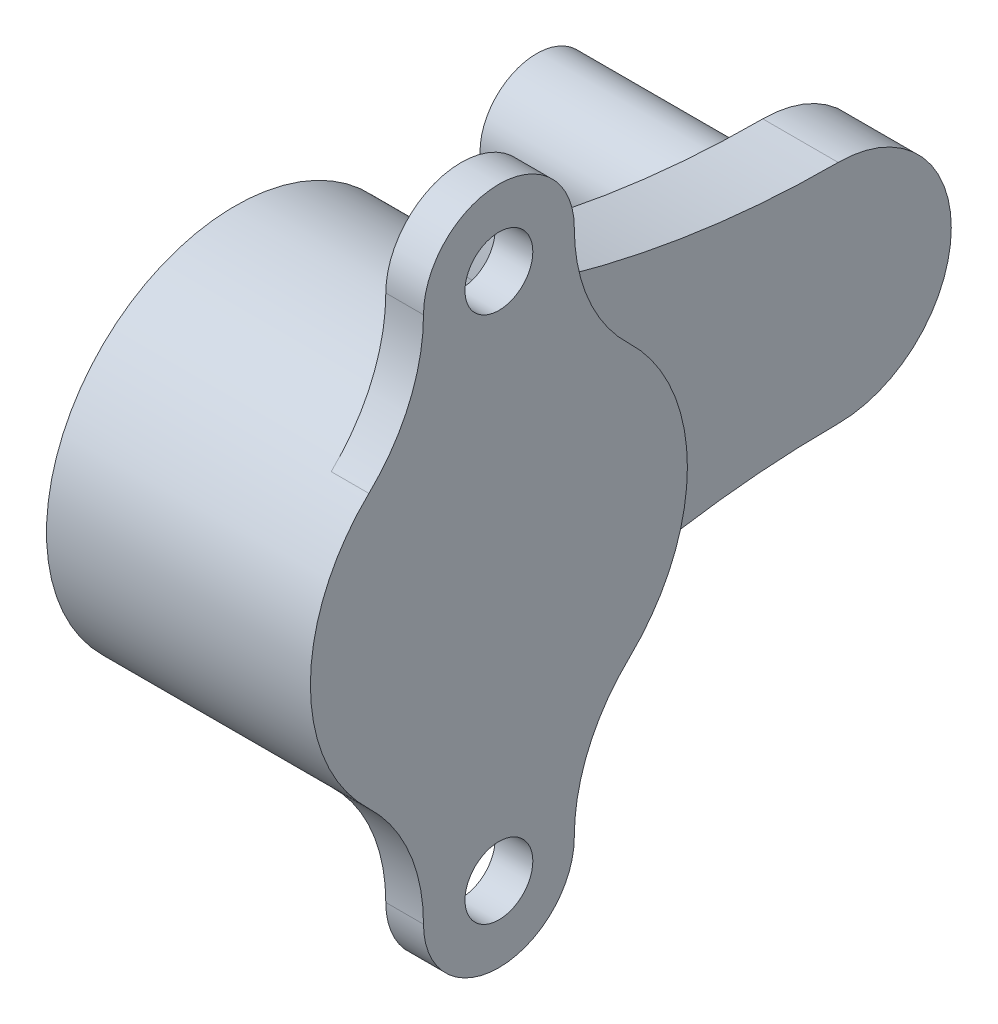
from build123d import *
from build123d.topology import SkipClean

# Parameters (mm, degrees)
FILLET1_R           = 1
SKETCH2_R           = 4.5
BOSS_EXTRUDE2_DEPTH = 5
BOSS_EXTRUDE3_DEPTH = 10
SKETCH4_R           = 7.5
BOSS_EXTRUDE4_DEPTH = 30


with BuildPart() as part:
    # Sketch1 → Revolve1 (revolve)
    with BuildSketch(Plane.XY, mode=Mode.PRIVATE) as revolve1_sk:
        Polygon((15, 25), (-15, 25), (-15, 22.5), (-12.5, 22.5), (-12.5, 7.5), (-15, 7.5), (-15, 5), (15, 5), align=None)
    revolve(revolve1_sk.sketch.rotate(Axis((0, 0, 0), (-1, 0, 0)), 90), axis=Axis((0, 0, 0), (-1, 0, 0)))

    # Fillet1
    fillet1_edges = [part.edges().sort_by_distance(p)[0] for p in [
        (-15, 0, 7.5),
    ]]
    fillet(fillet1_edges, radius=FILLET1_R)

    # Sketch2 → Boss-Extrude2 (add)
    with SkipClean():  # the faces are left unmerged after this step: merging them gives an invalid solid
        with BuildSketch(Plane(origin=(15, 0, 0), x_dir=(0, 0, -1), z_dir=(1, 0, 0))):
            with BuildLine():
                ThreePointArc((10, 35), (0, 45), (-10, 35))
                ThreePointArc((-10, 35), (-11.886615966, 25.8085497), (-17.24137931, 18.103448276))
                ThreePointArc((-17.24137931, 18.103448276), (-25, 0), (-17.24137931, -18.103448276))
                ThreePointArc((-17.24137931, -18.103448276), (-11.886615966, -25.8085497), (-10, -35))
                ThreePointArc((-10, -35), (0, -45), (10, -35))
                ThreePointArc((10, -35), (11.886615966, -25.8085497), (17.24137931, -18.103448276))
                ThreePointArc((17.24137931, -18.103448276), (25, 0), (17.24137931, 18.103448276))
                ThreePointArc((17.24137931, 18.103448276), (11.886615966, 25.8085497), (10, 35))
            make_face()
            with Locations((0, 35)):
                Circle(SKETCH2_R, mode=Mode.SUBTRACT)
            with Locations((0, -35)):
                Circle(SKETCH2_R, mode=Mode.SUBTRACT)
        extrude(amount=BOSS_EXTRUDE2_DEPTH)

    # Sketch3 → Boss-Extrude3 (add)
    with SkipClean():  # the faces are left unmerged after this step: merging them gives an invalid solid
        with BuildSketch(Plane(origin=(0, 0, 0), x_dir=(0, 0, -1), z_dir=(1, 0, 0))):
            with BuildLine():
                Line((8.8, 23.4), (8.8, -23.4))
                ThreePointArc((8.8, -23.4), (31.521286236, -17.117074299), (55, -15))
                ThreePointArc((55, -15), (70, 0), (55, 15))
                ThreePointArc((55, 15), (31.521286236, 17.117074299), (8.8, 23.4))
            make_face()
        extrude(amount=BOSS_EXTRUDE3_DEPTH)

    # Sketch4 → Boss-Extrude4 (add)
    with SkipClean():  # the faces are left unmerged after this step: merging them gives an invalid solid
        with BuildSketch(Plane.ZY):
            with Locations((-55, 0)):
                Circle(SKETCH4_R)
        extrude(amount=BOSS_EXTRUDE4_DEPTH)


solid = part.part
